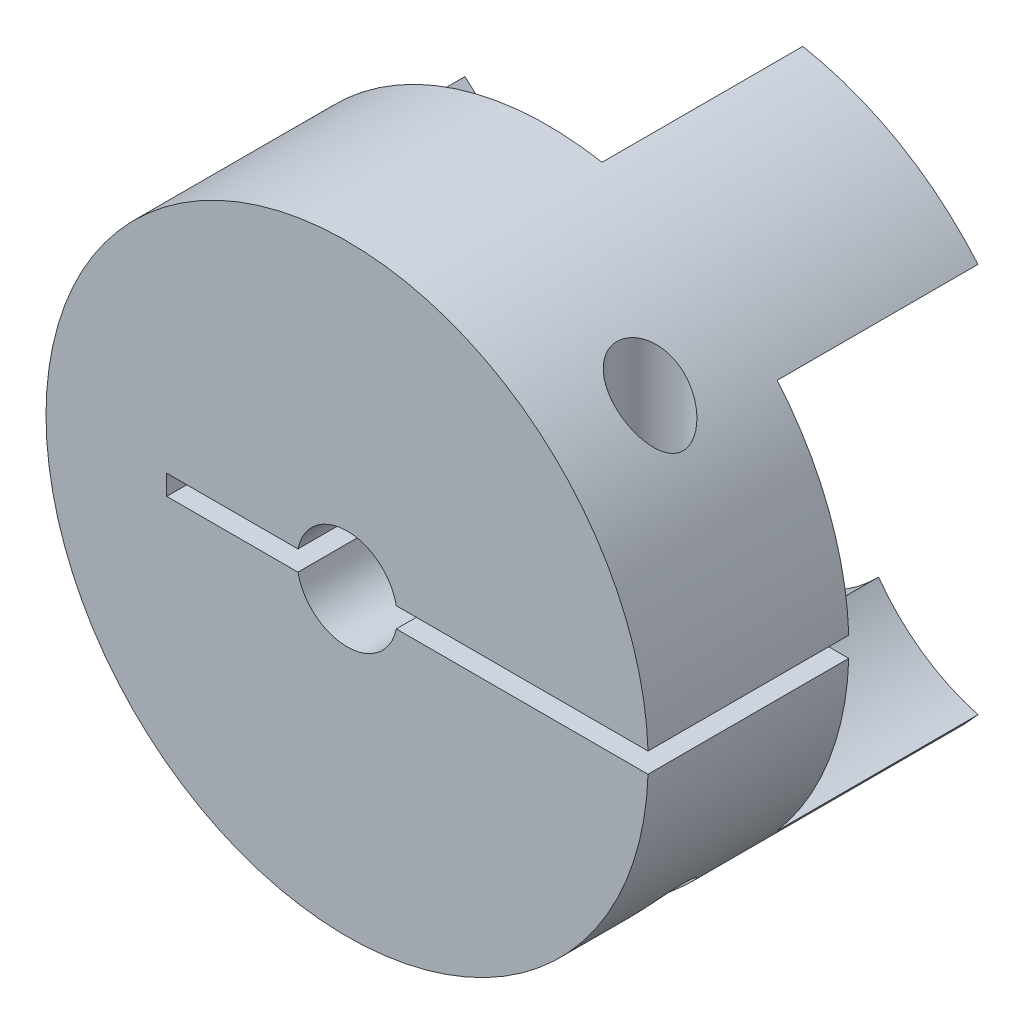
from build123d import *

# Parameters (mm, degrees)
SKETCH1_R             = 15
BOSS_EXTRUDE1_DEPTH   = 10
BOSS_EXTRUDE2_START   = -10
BOSS_EXTRUDE2_DEPTH   = 10
CUT_EXTRUDE1_DEPTH    = 10
SKETCH4_W             = 1.65
SKETCH4_H             = 14.5
M4X0_7_TAPPED_HOLE2_D = 3.3


with BuildPart() as part:
    # Sketch1 → Boss-Extrude1 (new body)
    with BuildSketch(Plane.XY):
        Circle(SKETCH1_R)
    extrude(amount=BOSS_EXTRUDE1_DEPTH)

    # Sketch1<3> → Boss-Extrude2 (add)
    with BuildSketch(Plane.XY.offset(BOSS_EXTRUDE2_START)):
        with BuildLine():
            ThreePointArc((-8.650131502, -2.485), (-9, 0), (-8.650131502, 2.485))
            ThreePointArc((-8.650131502, 2.485), (-11.609935014, 3.288891553), (-14.127929785, 5.04))
            ThreePointArc((-14.127929785, 5.04), (-15, 0), (-14.127929785, -5.04))
            ThreePointArc((-14.127929785, -5.04), (-11.609935014, -3.288891553), (-8.650131502, -2.485))
        make_face()
        with BuildLine():
            ThreePointArc((6.477138879, 6.248733627), (8.653231142, 8.410052882), (11.428732927, 9.715146096))
            ThreePointArc((11.428732927, 9.715146096), (7.5, 12.990381057), (2.699196857, 14.755146096))
            ThreePointArc((2.699196857, 14.755146096), (2.956703872, 11.698944435), (2.172992623, 8.733733627))
            ThreePointArc((2.172992623, 8.733733627), (4.5, 7.794228634), (6.477138879, 6.248733627))
        make_face()
        with BuildLine():
            ThreePointArc((2.699196857, -14.755146096), (7.5, -12.990381057), (11.428732927, -9.715146096))
            ThreePointArc((11.428732927, -9.715146096), (8.653231142, -8.410052882), (6.477138879, -6.248733627))
            ThreePointArc((6.477138879, -6.248733627), (4.5, -7.794228634), (2.172992623, -8.733733627))
            ThreePointArc((2.172992623, -8.733733627), (2.956703872, -11.698944435), (2.699196857, -14.755146096))
        make_face()
    extrude(amount=BOSS_EXTRUDE2_DEPTH)

    # Sketch2 → Cut-Extrude1 (cut)
    with BuildSketch(Plane(origin=(0, 0, 0), x_dir=(-1, 0, 0), z_dir=(0, 0, -1))):
        with BuildLine():
            ThreePointArc((-14.991664351, 0.5), (-15, 0), (-14.991664351, -0.5))
            Line((-14.991664351, -0.5), (-2.449489743, -0.5))
            ThreePointArc((-2.449489743, -0.5), (0, -2.5), (2.449489743, -0.5))
            Line((2.449489743, -0.5), (8.986100378, -0.5))
            ThreePointArc((8.986100378, -0.5), (9, 0), (8.986100378, 0.5))
            Line((8.986100378, 0.5), (2.449489743, 0.5))
            ThreePointArc((2.449489743, 0.5), (0, 2.5), (-2.449489743, 0.5))
            Line((-2.449489743, 0.5), (-14.991664351, 0.5))
        make_face()
    extrude(amount=-CUT_EXTRUDE1_DEPTH, mode=Mode.SUBTRACT)

    # Sketch4 → M4x0.7 Tapped Hole1 (revolve, cut)
    with BuildSketch(Plane(origin=(10.092684865, 0.5, 5), x_dir=(0, 0, -1), z_dir=(1, 0, 0))):
        with Locations((0.825, 7.25)):
            Rectangle(SKETCH4_W, SKETCH4_H)
    revolve(axis=Axis((10.092684865, -5.85, 5), (0, 1, 0)), mode=Mode.SUBTRACT)

    # M4x0.7 Tapped Hole2 (through all)
    with Locations(Plane(origin=(0, -0.5, 0), x_dir=(1, 0, 0), z_dir=(0, 1, 0))):
        with Locations((10.092684865, -5)):
            Hole(M4X0_7_TAPPED_HOLE2_D / 2)


solid = part.part
